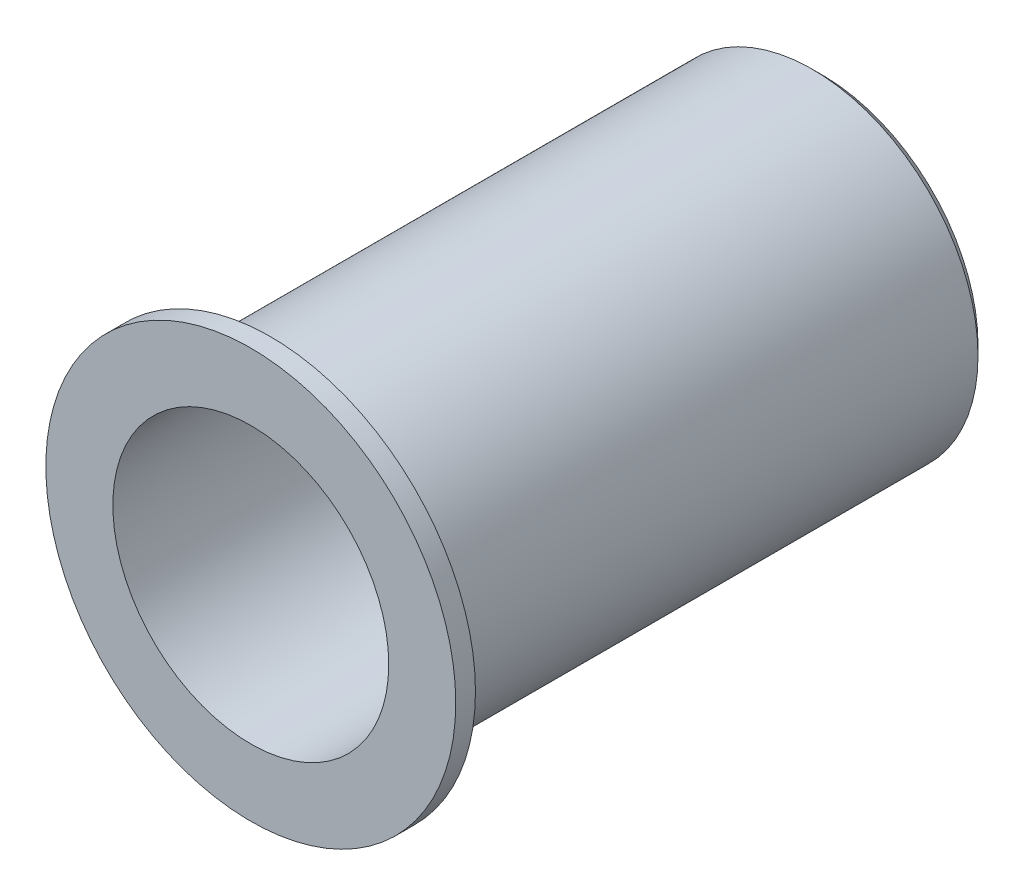
from build123d import *

# Parameters (mm, degrees)
SKETCH_1_R          = 8.4
EXTRUDE_1_DEPTH     = 28
SKETCH_2_R          = 7
CUT_EXTRUDE_3_DEPTH = 23
HOLE_WIZARD_M4_1_D  = 3.3
SKETCH_10_R         = 10.4
SKETCH_10_R_2       = 8.4
SKETCH_10_R_3       = 7
EXTRUDE_4_DEPTH     = 1
CHAMFER_1_SIZE      = 0.5


with BuildPart() as part:
    # 草图1 → 凸台-拉伸1 (new body)
    with BuildSketch(Plane.XY):
        Circle(SKETCH_1_R)
    extrude(amount=EXTRUDE_1_DEPTH)

    # 草图2 → 切除-拉伸3 (cut)
    with BuildSketch(Plane.XY.offset(28)):
        Circle(SKETCH_2_R)
    extrude(amount=-CUT_EXTRUDE_3_DEPTH, mode=Mode.SUBTRACT)

    # M4 螺纹孔1 (through all)
    with Locations(Plane(origin=(0, 0, 0), x_dir=(-1, 0, 0), z_dir=(0, 0, -1))):
        with Locations((0, 5), (0, 0), (-4.330127019, -2.5), (4.330127019, -2.5)):
            Hole(HOLE_WIZARD_M4_1_D / 2)

    # 草图10 → 凸台-拉伸4 (add)
    # profile 1 of 2: a face of its own
    with BuildSketch(Plane.XY.offset(28)):
        Circle(SKETCH_10_R)
        Circle(SKETCH_10_R_2, mode=Mode.SUBTRACT)
    # profile 2 of 2: a face of its own
    with BuildSketch(Plane.XY.offset(28)):
        Circle(SKETCH_10_R_2)
        Circle(SKETCH_10_R_3, mode=Mode.SUBTRACT)
    extrude(amount=EXTRUDE_4_DEPTH)

    # 倒角1
    chamfer_1_edges = [part.edges().sort_by_distance(p)[0] for p in [
        (-8.4, 0, 0),
    ]]
    chamfer(chamfer_1_edges, length=CHAMFER_1_SIZE)


solid = part.part
